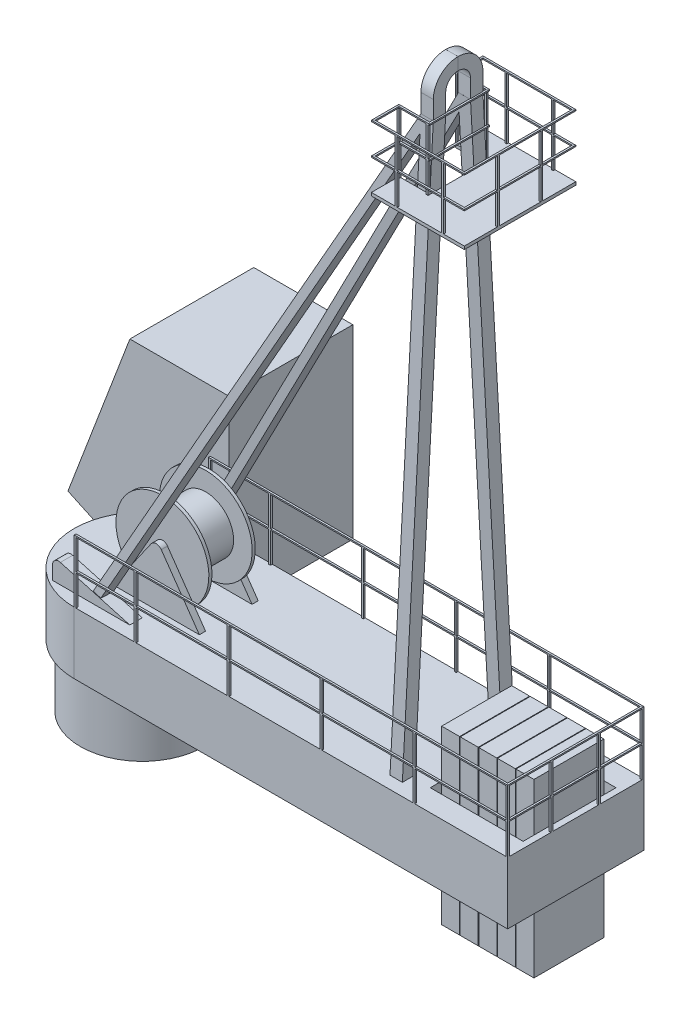
from build123d import *

# Parameters (mm, degrees)
SKETCH1_R            = 1000
BOSS_EXTRUDE1_DEPTH  = 1000
SKETCH2_W            = 1500
SKETCH2_H            = 1500
BOSS_EXTRUDE2_DEPTH  = 1000
SKETCH3_W            = 1131.11489938
SKETCH3_H            = 2777.030372183
BOSS_EXTRUDE3_DEPTH  = 290
LPATTERN1_COUNT      = 5
LPATTERN1_PITCH      = 300
BOSS_EXTRUDE4_DEPTH  = 200
BOSS_EXTRUDE6_DEPTH  = 200
BOSS_EXTRUDE7_DEPTH  = 100
BOSS_EXTRUDE8_DEPTH  = 200
BOSS_EXTRUDE9_DEPTH  = 50
SKETCH10_W           = 30
SKETCH10_H           = 30
BOSS_EXTRUDE10_DEPTH = 1000
SKETCH19_W           = 30
SKETCH19_H           = 20
SKETCH20_W           = 30
SKETCH20_H           = 30
BOSS_EXTRUDE11_DEPTH = 1000
LPATTERN2_COUNT      = 2
LPATTERN2_PITCH      = 500
SKETCH22_W           = 30
SKETCH22_H           = 20
LPATTERN3_COUNT      = 2
LPATTERN3_PITCH      = 500
SKETCH23_W           = 2000
SKETCH23_H           = 3000
BOSS_EXTRUDE12_DEPTH = 300
BOSS_EXTRUDE13_DEPTH = 2000


with BuildPart() as part:
    # Sketch1 → Boss-Extrude1 (new body)
    with BuildSketch(Plane(origin=(0, 0, 0), x_dir=(1, 0, 0), z_dir=(0, 1, 0))):
        with Locations(Location((0, 0, 0), (0, 0, 270))):
            Circle(SKETCH1_R)
    extrude(amount=BOSS_EXTRUDE1_DEPTH)

    # Sketch2 → Boss-Extrude2 (add)
    with BuildSketch(Plane(origin=(0, 1000, 0), x_dir=(1, 0, 0), z_dir=(0, 1, 0))):
        with BuildLine():
            Line((7000, -1100), (0, -1100))
            ThreePointArc((0, -1100), (-1100, 0), (0, 1100))
            Line((0, 1100), (7000, 1100))
            Line((7000, 1100), (7000, -1100))
        make_face()
        with Locations((6150, 0)):
            Rectangle(SKETCH2_W, SKETCH2_H, mode=Mode.SUBTRACT)
    extrude(amount=BOSS_EXTRUDE2_DEPTH)

    # Sketch4 → Boss-Extrude4 (add)
    with BuildSketch(Plane(origin=(4900, 0, 0), x_dir=(0, 0, -1), z_dir=(1, 0, 0))):
        with BuildLine():
            Line((-400.308024617, 11300), (-400.308024617, 11000))
            Line((-400.308024617, 11000), (-200.308024617, 11000))
            Line((-200.308024617, 11000), (-200.308024617, 11300))
            ThreePointArc((-200.308024617, 11300), (-141.685140206, 11441.528162612), (-0.156977594, 11500.151047024))
            Line((-0.156977594, 11500.151047024), (-0.156977594, 11700.151047024))
            ThreePointArc((-0.156977594, 11700.151047024), (-283.106496443, 11582.949518849), (-400.308024617, 11300))
        make_face()
        Polygon((-699.691975383, 2000), (-900, 2000), (-400.308024617, 11000), (-200, 11000), align=None)
    boss_extrude4 = extrude(amount=BOSS_EXTRUDE4_DEPTH)

    # Sketch5 → Boss-Extrude6 (add)
    with BuildSketch(Plane(origin=(0, 55.961924596, 1007.93558068), x_dir=(1, 0, 0), z_dir=(0, 0.055435952407980556, 0.9984622452454676))):
        Polygon((0, 1935.944942842), (4900, 10960.893241099), (4900, 10693.507651895), (145.174170954, 1935.944942842), align=None)
    boss_extrude6 = extrude(amount=-BOSS_EXTRUDE6_DEPTH)



with BuildPart() as body_2:
    # Sketch3 → Boss-Extrude3 (new body)
    with BuildSketch(Plane(origin=(5400, 0, 0), x_dir=(0, 0, -1), z_dir=(1, 0, 0))):
        with Locations((0, 1380.350690099)):
            Rectangle(SKETCH3_W, SKETCH3_H)
    boss_extrude3 = extrude(amount=BOSS_EXTRUDE3_DEPTH)


with BuildPart() as lpattern1_1:
    # LPattern1: Boss-Extrude3 ×5
    with Locations(*[(i * LPATTERN1_PITCH, 0, 0) for i in range(1, LPATTERN1_COUNT)]):
        add(boss_extrude3)


with BuildPart() as body_7:
    # Sketch6 → Revolve1 (revolve)
    with BuildSketch(Plane(origin=(0, 2800, 0), x_dir=(1, 0, 0), z_dir=(0, 1, 0)), mode=Mode.PRIVATE) as revolve1_sk:
        Polygon((700, 375), (700, -375), (1450, -375), (1450, -325), (1150, -325), (1150, 325), (1450, 325), (1450, 375), align=None)
    revolve(revolve1_sk.sketch.rotate(Axis((700, 2800, -375), (0, 0, 1)), 180), axis=Axis((700, 2800, -375), (0, 0, 1)))


with BuildPart() as part_1:
    add(part.part)

    add(body_7.part)  # Boss-Extrude7 merges body 7
    # Sketch7 → Boss-Extrude7 (add)
    with BuildSketch(Plane.XY.offset(375)):
        with BuildLine():
            Line((0, 2000), (617.899414001, 2882.713448574))
            ThreePointArc((617.899414001, 2882.713448574), (699.924187125, 2925.367162544), (781.862134816, 2882.546893399))
            Line((781.862134816, 2882.546893399), (1396.97717825, 2000))
            Line((1396.97717825, 2000), (0, 2000))
        make_face()
    boss_extrude7 = extrude(amount=BOSS_EXTRUDE7_DEPTH)

    # Sketch8 → Boss-Extrude8 (add)
    with BuildSketch(Plane.XY.offset(900)):
        with BuildLine():
            Line((-550, 2000), (-550, 2218.110918861))
            ThreePointArc((-550, 2218.110918861), (-510.41802019, 2297.795690532), (-423.006743274, 2314.398841735))
            Line((-423.006743274, 2314.398841735), (698.488589125, 2000))
            Line((698.488589125, 2000), (-550, 2000))
        make_face()
    boss_extrude8 = extrude(amount=-BOSS_EXTRUDE8_DEPTH)

    # Mirror1: Boss-Extrude4, Boss-Extrude6, Boss-Extrude7, Boss-Extrude8 across plane
    add(boss_extrude4.mirror(Plane.XY))
    add(boss_extrude6.mirror(Plane.XY))
    add(boss_extrude7.mirror(Plane.XY))
    add(boss_extrude8.mirror(Plane.XY))

    # Sketch9 → Boss-Extrude9 (add)
    with BuildSketch(Plane(origin=(0, 10000, 0), x_dir=(1, 0, 0), z_dir=(0, 1, 0))):
        Polygon((5100, -455.829355215), (4600, -455.829355215), (4600, -900), (6100, -900), (6100, 900), (4600, 900), (4600, 455.829355215), (5100, 455.829355215), align=None)
    extrude(amount=-BOSS_EXTRUDE9_DEPTH)

    # Sketch10 → Boss-Extrude10 (add)
    with BuildSketch(Plane(origin=(0, 10000, 0), x_dir=(1, 0, 0), z_dir=(0, 1, 0))):
        with Locations((6085, -350)):
            Rectangle(SKETCH10_W, SKETCH10_H)
        with Locations((5750, -885)):
            Rectangle(SKETCH10_W, SKETCH10_H)
        with Locations((5000, -885)):
            Rectangle(SKETCH10_W, SKETCH10_H)
        with Locations((5000, 885)):
            Rectangle(SKETCH10_W, SKETCH10_H)
        with Locations((5750, 885)):
            Rectangle(SKETCH10_W, SKETCH10_H)
        with Locations((6085, 350)):
            Rectangle(SKETCH10_W, SKETCH10_H)
        with Locations((4615, -470.829355215)):
            Rectangle(SKETCH10_W, SKETCH10_H)
        with Locations((5085, -470.829355215)):
            Rectangle(SKETCH10_W, SKETCH10_H)
        with Locations((5085, 470.829355215)):
            Rectangle(SKETCH10_W, SKETCH10_H)
        with Locations((4615, 470.829355215)):
            Rectangle(SKETCH10_W, SKETCH10_H)
    extrude(amount=BOSS_EXTRUDE10_DEPTH)

    # Sweep3: sweep along a path in Sketch11
    with BuildLine(Plane(origin=(0, 11000, 0), x_dir=(1, 0, 0), z_dir=(0, 1, 0))) as sweep3_path:
        Line((5110, -470.829355215), (4615, -470.829355215))
        Line((4615, -470.829355215), (4615, -885))
        Line((4615, -885), (6085, -885))
        Line((6085, -885), (6085, 885))
        Line((6085, 885), (4615, 885))
        Line((4615, 885), (4615, 470.829355215))
        Line((4615, 470.829355215), (5110, 470.829355215))
        Line((5110, 470.829355215), (5110, -470.829355215))
    # Sketch19 → Sweep3 (sweep)
    with BuildSketch(Plane.XY.offset(485.829355215)):
        with Locations((4615, 11000)):
            Rectangle(SKETCH19_W, SKETCH19_H)
    sweep3 = sweep(path=sweep3_path.line, transition=Transition.RIGHT)

    # Sketch20 → Boss-Extrude11 (add)
    with BuildSketch(Plane(origin=(0, 2000, 0), x_dir=(1, 0, 0), z_dir=(0, 1, 0))):
        with Locations((5485, -1085)):
            Rectangle(SKETCH20_W, SKETCH20_H)
        with Locations((6985, -1085)):
            Rectangle(SKETCH20_W, SKETCH20_H)
        with Locations((3985, -1085)):
            Rectangle(SKETCH20_W, SKETCH20_H)
        with Locations((2485, -1085)):
            Rectangle(SKETCH20_W, SKETCH20_H)
        with Locations((985, -1085)):
            Rectangle(SKETCH20_W, SKETCH20_H)
        with Locations((6985, -385)):
            Rectangle(SKETCH20_W, SKETCH20_H)
        with Locations((15, -1085)):
            Rectangle(SKETCH20_W, SKETCH20_H)
        with Locations((6985, 385)):
            Rectangle(SKETCH20_W, SKETCH20_H)
        with Locations((15, 1085)):
            Rectangle(SKETCH20_W, SKETCH20_H)
        with Locations((985, 1085)):
            Rectangle(SKETCH20_W, SKETCH20_H)
        with Locations((2485, 1085)):
            Rectangle(SKETCH20_W, SKETCH20_H)
        with Locations((3985, 1085)):
            Rectangle(SKETCH20_W, SKETCH20_H)
        with Locations((5485, 1085)):
            Rectangle(SKETCH20_W, SKETCH20_H)
        with Locations((6985, 1085)):
            Rectangle(SKETCH20_W, SKETCH20_H)
    extrude(amount=BOSS_EXTRUDE11_DEPTH)

    # LPattern2: Sweep3 ×2
    with Locations(*[(0, -i * LPATTERN2_PITCH, 0) for i in range(1, LPATTERN2_COUNT)]):
        add(sweep3)

    # Sweep4: sweep along a path in Sketch21
    with BuildLine(Plane(origin=(0, 3000, 0), x_dir=(1, 0, 0), z_dir=(0, 1, 0))) as sweep4_path:
        Line((0, -1085), (6985, -1085))
        Line((6985, -1085), (6985, 1085))
        Line((6985, 1085), (0, 1085))
    # Sketch22 → Sweep4 (sweep)
    with BuildSketch(Plane.ZY):
        with Locations((1085, 3000)):
            Rectangle(SKETCH22_W, SKETCH22_H)
    sweep4 = sweep(path=sweep4_path.line, transition=Transition.RIGHT)

    # LPattern3: Sweep4 ×2
    with Locations(*[(0, -i * LPATTERN3_PITCH, 0) for i in range(1, LPATTERN3_COUNT)]):
        add(sweep4)

    # Sketch23 → Boss-Extrude12 (add, symmetric)
    with BuildSketch(Plane(origin=(0, 0, 0), x_dir=(0, 0, -1), z_dir=(1, 0, 0))):
        with Locations((2100, 2500)):
            Rectangle(SKETCH23_W, SKETCH23_H)
    extrude(amount=BOSS_EXTRUDE12_DEPTH, both=True)

    # Sketch24 → Boss-Extrude13 (add)
    with BuildSketch(Plane(origin=(0, 0, -3100), x_dir=(-1, 0, 0), z_dir=(0, 0, -1))):
        Polygon((300, 4000), (1300, 4000), (2300, 1373.046126524), (1500, 1000), (300, 1000), align=None)
    extrude(amount=-BOSS_EXTRUDE13_DEPTH)


solid = Compound([body_2.part, lpattern1_1.part, part_1.part])
